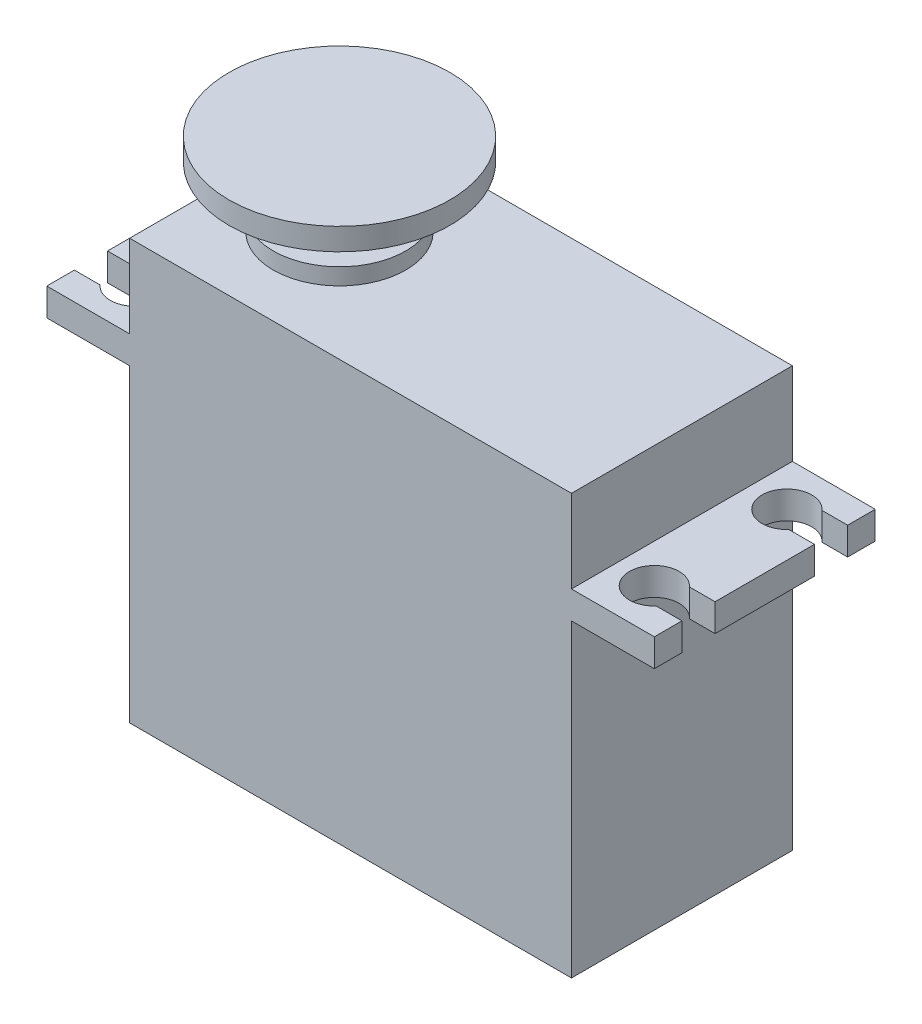
from build123d import *

# Parameters (mm, degrees)
SKETCH1_W            = 40
SKETCH1_H            = 20
BOSS_EXTRUDE1_DEPTH  = 38
SKETCH2_W            = 20
SKETCH2_H            = 2.5
BOSS_EXTRUDE2_DEPTH  = 7.5
CUT_EXTRUDE1_DEPTH   = 43.267008411
MIRROR2_COPY_1_DEPTH = 43.267008411
SKETCH4_R            = 6
BOSS_EXTRUDE3_DEPTH  = 1.5
SKETCH6_R            = 4
BOSS_EXTRUDE4_DEPTH  = 2
SKETCH7_R            = 4.5
BOSS_EXTRUDE5_DEPTH  = 2
SKETCH8_R            = 10
BOSS_EXTRUDE6_DEPTH  = 2


with BuildPart() as part:
    # Sketch1 → Boss-Extrude1 (new body)
    with BuildSketch(Plane(origin=(0, 0, 0), x_dir=(1, 0, 0), z_dir=(0, 1, 0))):
        Rectangle(SKETCH1_W, SKETCH1_H)
    extrude(amount=BOSS_EXTRUDE1_DEPTH)

    # Sketch2 → Boss-Extrude2 (add)
    with BuildSketch(Plane(origin=(20, 0, 0), x_dir=(0, 0, -1), z_dir=(1, 0, 0))):
        with Locations((0, 29.25)):
            Rectangle(SKETCH2_W, SKETCH2_H)
    boss_extrude2 = extrude(amount=BOSS_EXTRUDE2_DEPTH)

    # Sketch3 → Cut-Extrude1 (cut, through all)
    with BuildSketch(Plane(origin=(0, 30.5, 0), x_dir=(1, 0, 0), z_dir=(0, 1, 0))):
        with BuildLine():
            Line((27.5, -7.5), (27.5, -4.5))
            Line((27.5, -4.5), (25.177050983, -4.5))
            ThreePointArc((25.177050983, -4.5), (21.25, -6), (25.177050983, -7.5))
            Line((25.177050983, -7.5), (27.5, -7.5))
        make_face()
    cut_extrude1 = extrude(amount=-CUT_EXTRUDE1_DEPTH, mode=Mode.SUBTRACT)

    # Mirror1: Cut-Extrude1 across plane
    add(cut_extrude1.mirror(Plane.XY), mode=Mode.SUBTRACT)

    # Mirror2: Boss-Extrude2, Cut-Extrude1 across plane
    add(boss_extrude2.mirror(Plane(origin=(0, 0, 0), x_dir=(0, 0, 1), z_dir=(1, 0, 0))))
    add(cut_extrude1.mirror(Plane(origin=(0, 0, 0), x_dir=(0, 0, 1), z_dir=(1, 0, 0))), mode=Mode.SUBTRACT)

    # Mirror2 copy 1 sketch → Mirror2 copy 1 (cut, through all)
    with BuildSketch(Plane(origin=(0, 30.5, 0), x_dir=(-1, 0, 0), z_dir=(0, 1, 0))):
        with BuildLine():
            Line((27.5, -7.5), (27.5, -4.5))
            Line((27.5, -4.5), (25.177050983, -4.5))
            ThreePointArc((25.177050983, -4.5), (21.25, -6), (25.177050983, -7.5))
            Line((25.177050983, -7.5), (27.5, -7.5))
        make_face()
    extrude(amount=-MIRROR2_COPY_1_DEPTH, mode=Mode.SUBTRACT)

    # Sketch4 → Boss-Extrude3 (add)
    with BuildSketch(Plane(origin=(0, 38, 0), x_dir=(1, 0, 0), z_dir=(0, 1, 0))):
        with Locations(Location((-11, 0, 0), (0, 0, 270))):
            Circle(SKETCH4_R)
    extrude(amount=BOSS_EXTRUDE3_DEPTH)

    # Sketch6 → Boss-Extrude4 (add)
    with BuildSketch(Plane(origin=(0, 39.5, 0), x_dir=(1, 0, 0), z_dir=(0, 1, 0))):
        with Locations(Location((-11, 0, 0), (0, 0, 270))):
            Circle(SKETCH6_R)
    extrude(amount=BOSS_EXTRUDE4_DEPTH)

    # Sketch7 → Boss-Extrude5 (add)
    with BuildSketch(Plane(origin=(0, 41.5, 0), x_dir=(1, 0, 0), z_dir=(0, 1, 0))):
        with Locations(Location((-11, 0, 0), (0, 0, 270))):
            Circle(SKETCH7_R)
    extrude(amount=BOSS_EXTRUDE5_DEPTH)


with BuildPart() as body_2:
    # Sketch8 → Boss-Extrude6 (new body)
    with BuildSketch(Plane(origin=(0, 43.5, 0), x_dir=(1, 0, 0), z_dir=(0, 1, 0))):
        with Locations(Location((-11, 0, 0), (0, 0, 270))):
            Circle(SKETCH8_R)
    extrude(amount=BOSS_EXTRUDE6_DEPTH)


solid = Compound([part.part, body_2.part])
